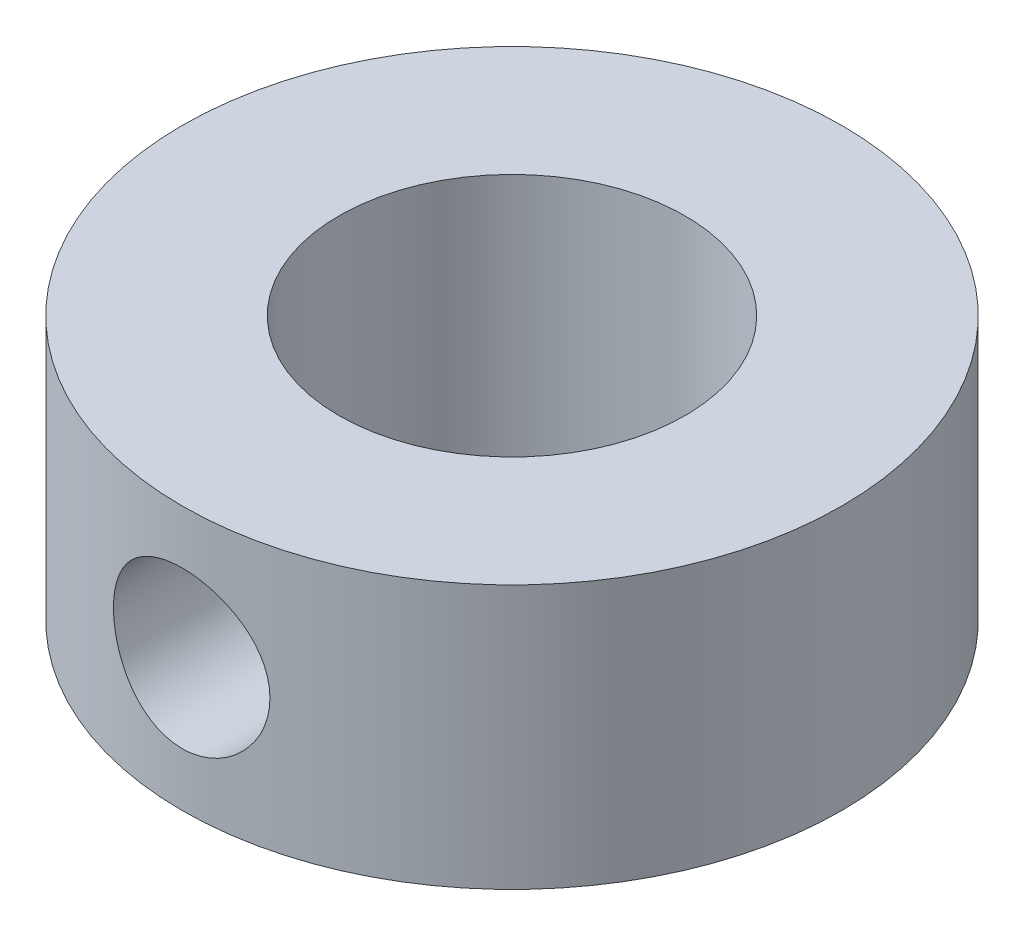
from build123d import *

# Parameters (mm, degrees)
SKETCH1_R           = 4.7625
SKETCH1_R_2         = 2.5
BOSS_EXTRUDE1_DEPTH = 3.81
SKETCH3_W           = 1.1303
SKETCH3_H           = 4.7625


with BuildPart() as part:
    # Sketch1 → Boss-Extrude1 (new body)
    with BuildSketch(Plane(origin=(0, 0, 0), x_dir=(1, 0, 0), z_dir=(0, 1, 0))):
        with Locations(Location((0, 0, 0), (0, 0, 90))):
            Circle(SKETCH1_R)
        with Locations(Location((0, 0, 0), (0, 0, 90))):
            Circle(SKETCH1_R_2, mode=Mode.SUBTRACT)
    extrude(amount=BOSS_EXTRUDE1_DEPTH)

    # Sketch3 → #4-40 Tapped Hole1 (revolve, cut)
    with BuildSketch(Plane(origin=(0, 1.905, 0), x_dir=(0, 1, 0), z_dir=(1, 0, 0))):
        with Locations((0.56515, 2.38125)):
            Rectangle(SKETCH3_W, SKETCH3_H)
    revolve(axis=Axis((0, 1.905, -6.35), (0, 0, 1)), mode=Mode.SUBTRACT)


solid = part.part
